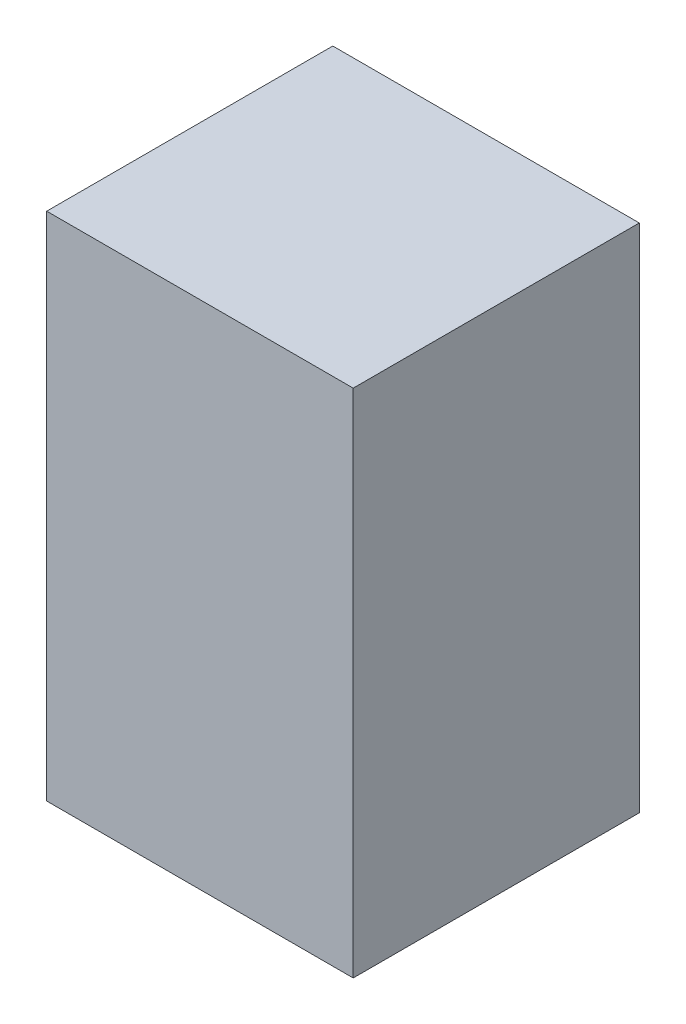
from build123d import *

# Parameters (mm, degrees)
CROQUIS1_W              = 45
CROQUIS1_H              = 42
SALIENTE_EXTRUIR1_DEPTH = 75


with BuildPart() as part:
    # Croquis1 → Saliente-Extruir1 (new body)
    with BuildSketch(Plane(origin=(0, 0, 0), x_dir=(1, 0, 0), z_dir=(0, 1, 0))):
        Rectangle(CROQUIS1_W, CROQUIS1_H)
    extrude(amount=-SALIENTE_EXTRUIR1_DEPTH)


solid = part.part
